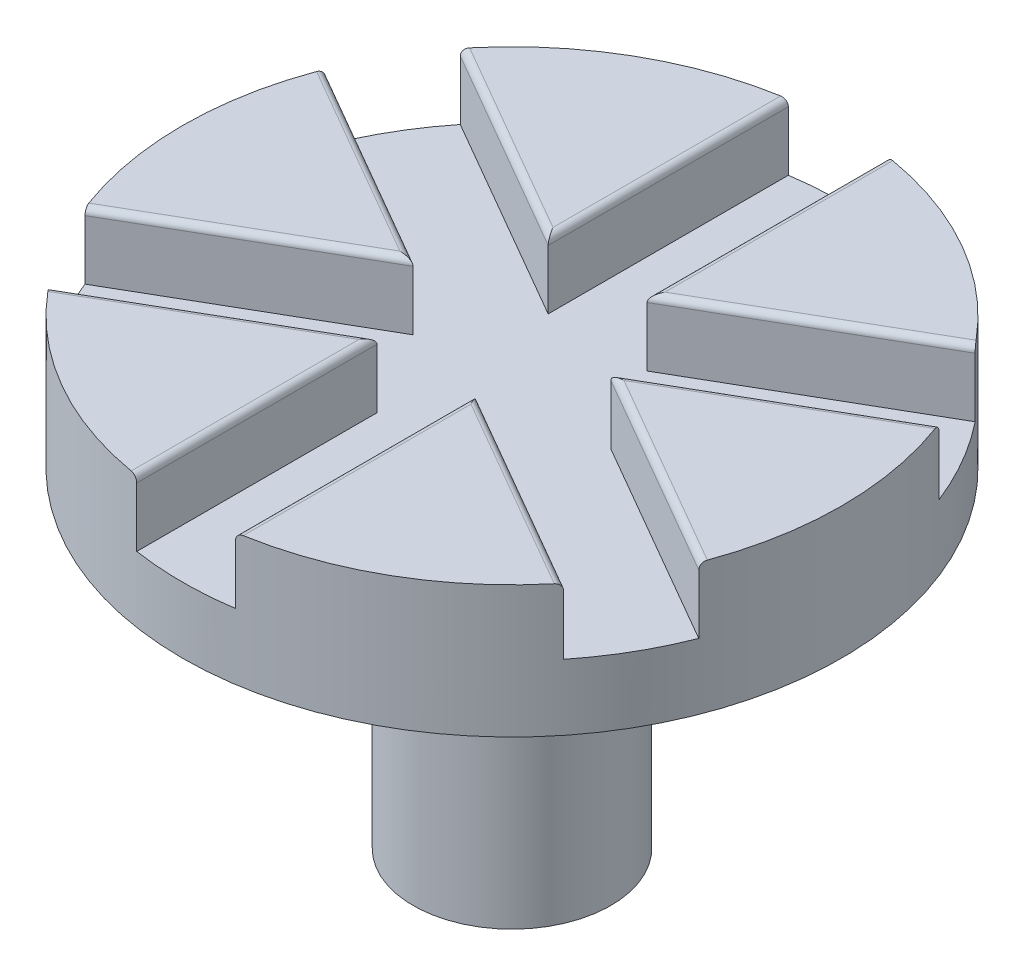
from build123d import *

# Parameters (mm, degrees)
SKETCH1_R           = 127
BOSS_EXTRUDE1_DEPTH = 25.4
BOSS_EXTRUDE2_DEPTH = 25.4
SKETCH3_R           = 38.1
BOSS_EXTRUDE3_DEPTH = 127
FILLET1_R           = 2.54


with BuildPart() as part:
    # Sketch1 → Boss-Extrude1 (new body)
    with BuildSketch(Plane(origin=(0, 0, 0), x_dir=(1, 0, 0), z_dir=(0, 1, 0))):
        with Locations(Location((0, 0, 0), (0, 0, 90))):
            Circle(SKETCH1_R)
    extrude(amount=BOSS_EXTRUDE1_DEPTH)

    # Sketch2 → Boss-Extrude2 (add)
    with BuildSketch(Plane(origin=(0, 25.4, 0), x_dir=(1, 0, 0), z_dir=(0, 1, 0))):
        with BuildLine():
            Line((-118.25364463, -46.314960129), (-38.1, 0))
            Line((-38.1, 0), (-118.265853064, 46.283776846))
            ThreePointArc((-118.265853064, 46.283776846), (-126.999998896, -0.016743976), (-118.25364463, -46.314960129))
        make_face()
        with BuildLine():
            Line((-99.215853064, 79.27934473), (-19.05, 32.995567884))
            Line((-19.05, 32.995567884), (-19.05, 125.563121576))
            ThreePointArc((-19.05, 125.563121576), (-63.5, 109.985226281), (-99.215853064, 79.27934473))
        make_face()
        with BuildLine():
            Line((19.05, 125.563121576), (19.05, 32.995567884))
            Line((19.05, 32.995567884), (99.215853064, 79.27934473))
            ThreePointArc((99.215853064, 79.27934473), (63.5, 109.985226281), (19.05, 125.563121576))
        make_face()
        with BuildLine():
            Line((118.265853064, 46.283776846), (38.1, 0))
            Line((38.1, 0), (118.265853064, -46.283776846))
            ThreePointArc((118.265853064, -46.283776846), (124.79736243, -23.550336101), (127, 0))
            ThreePointArc((127, 0), (124.79736243, 23.550336101), (118.265853064, 46.283776846))
        make_face()
        with BuildLine():
            Line((99.215853064, -79.27934473), (19.05, -32.995567884))
            Line((19.05, -32.995567884), (19.05, -125.563121576))
            ThreePointArc((19.05, -125.563121576), (63.5, -109.985226281), (99.215853064, -79.27934473))
        make_face()
        with BuildLine():
            Line((-19.05, -125.563121576), (-19.05, -32.995567884))
            Line((-19.05, -32.995567884), (-99.194944867, -79.305503673))
            ThreePointArc((-99.194944867, -79.305503673), (-63.485498739, -109.993597313), (-19.05, -125.563121576))
        make_face()
    extrude(amount=BOSS_EXTRUDE2_DEPTH)

    # Sketch3 → Boss-Extrude3 (add)
    with BuildSketch(Plane.XZ):
        with Locations(Location((0, 0, 0), (0, 0, 270))):
            Circle(SKETCH3_R)
    extrude(amount=BOSS_EXTRUDE3_DEPTH)

    # Fillet1
    fillet1_edges = [part.edges().sort_by_distance(p)[0] for p in [
        (-59.132926532, 50.8, -56.137456307),
        (-19.05, 50.8, -79.27934473),
        (19.05, 50.8, -79.27934473),
        (59.132926532, 50.8, -56.137456307),
        (78.182926532, 50.8, -23.141888423),
        (78.182926532, 50.8, 23.141888423),
        (59.132926532, 50.8, 56.137456307),
        (19.05, 50.8, 79.27934473),
        (-19.05, 50.8, 79.27934473),
        (-59.122472434, 50.8, 56.150535779),
        (-78.176822315, 50.8, 23.157480064),
        (-78.182926532, 50.8, -23.141888423),
    ]]
    fillet(fillet1_edges, radius=FILLET1_R)


solid = part.part
